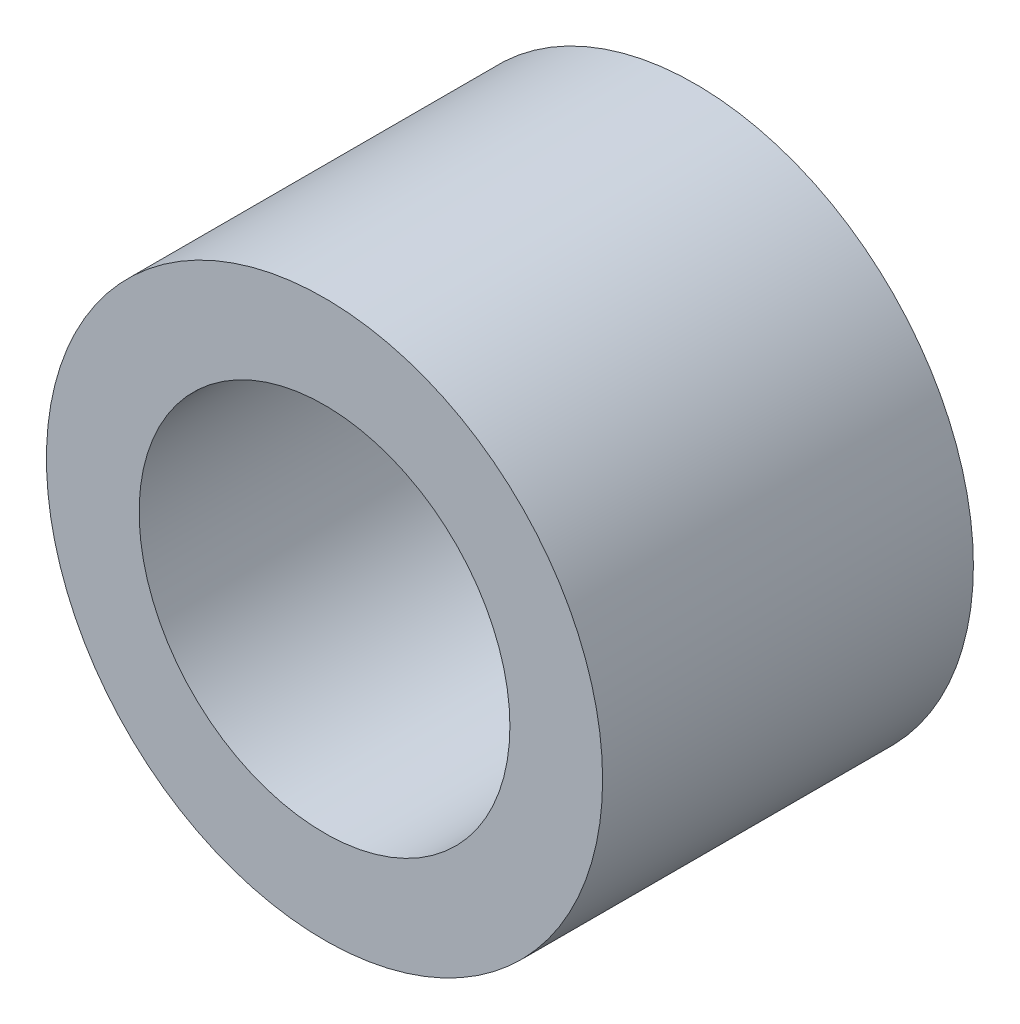
from build123d import *

# Parameters (mm, degrees)
SKETCH_1_R          = 3
EXTRUDE_1_DEPTH     = 4
SKETCH_2_R          = 2
CUT_EXTRUDE_1_DEPTH = 6.830951895


with BuildPart() as part:
    # ｽｹｯﾁ1 → ﾎﾞｽ - 押し出し1 (new body)
    with BuildSketch(Plane.XY):
        Circle(SKETCH_1_R)
    extrude(amount=EXTRUDE_1_DEPTH)

    # ｽｹｯﾁ2 → ｶｯﾄ - 押し出し1 (cut, through all)
    with BuildSketch(Plane.XY.offset(4)):
        Circle(SKETCH_2_R)
    extrude(amount=-CUT_EXTRUDE_1_DEPTH, mode=Mode.SUBTRACT)


solid = part.part
